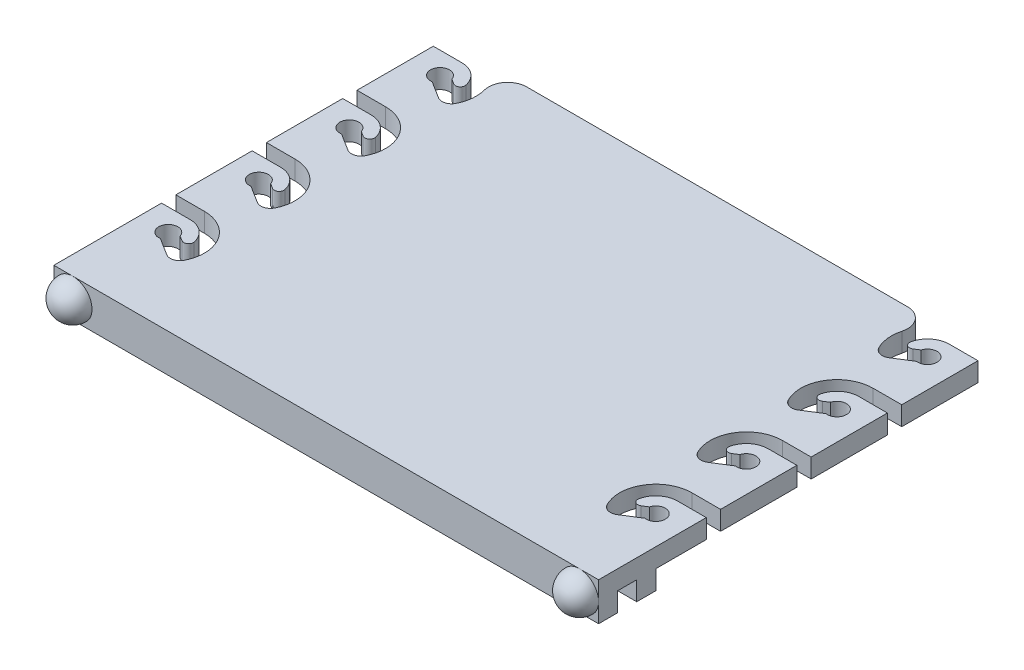
from build123d import *

# Parameters (mm, degrees)
SKETCH1_W            = 57.131427428
SKETCH1_H            = 41
BOSS_EXTRUDE1_DEPTH  = 2
SKETCH2_W            = 28.565713714
SKETCH2_H            = 2
BOSS_EXTRUDE2_DEPTH  = 2
CUT_EXTRUDE4_DEPTH   = 2
LPATTERN1_COUNT      = 4
LPATTERN1_PITCH      = 9.5
MIRROR2_COPY_1_DEPTH = 2
MIRROR2_COPY_2_DEPTH = 2
MIRROR2_COPY_3_DEPTH = 2
FILLET1_R            = 1
FILLET2_R            = 2


with BuildPart() as part:
    # Sketch1 → Boss-Extrude1 (new body)
    with BuildSketch(Plane(origin=(0, 0, 0), x_dir=(1, 0, 0), z_dir=(0, 1, 0))):
        with Locations((0, 20.5)):
            Rectangle(SKETCH1_W, SKETCH1_H)
    extrude(amount=BOSS_EXTRUDE1_DEPTH)

    # Sketch2 → Boss-Extrude2 (add)
    with BuildSketch(Plane.XZ):
        with Locations((-14.282856857, -1)):
            Rectangle(SKETCH2_W, SKETCH2_H)
        with Locations((14.282856857, -1)):
            Rectangle(SKETCH2_W, SKETCH2_H)
        Polygon((1.5, -20), (3.5, -20), (3.5, -6), (28.565713714, -6), (28.565713714, -4), (1.5, -4), align=None)
        Polygon((-28.565713714, -6), (-28.565713714, -4), (-1.5, -4), (-1.5, -20), (-3.5, -20), (-3.5, -6), align=None)
    extrude(amount=BOSS_EXTRUDE2_DEPTH)

    # Sketch4 → Revolve1 (revolve)
    with BuildSketch(Plane.XZ):
        with BuildLine():
            Line((-26.565713714, 0), (-28.565713714, 0))
            ThreePointArc((-28.565713714, 0), (-27.979927277, 1.414213562), (-26.565713714, 2))
            Line((-26.565713714, 2), (-26.565713714, 0))
        make_face()
    revolve1 = revolve(axis=Axis((-26.565713714, 0, 0), (0, 0, 1)))

    # Mirror1: Revolve1 across plane
    add(revolve1.mirror(Plane(origin=(0, 0, 0), x_dir=(0, 0, 1), z_dir=(1, 0, 0))))

    # Sketch7 → Cut-Extrude4 (cut)
    with BuildSketch(Plane(origin=(0, 2, 0), x_dir=(1, 0, 0), z_dir=(0, 1, 0))):
        with BuildLine():
            Line((-24.076247257, 8.949248512), (-24.606518128, 9.282743394))
            ThreePointArc((-24.606518128, 9.282743394), (-26.412219505, 9.532379514), (-25.405087398, 8.012984708))
            Line((-25.405087398, 8.012984708), (-24.129168598, 7.210541254))
            Line((-24.129168598, 7.210541254), (-23.60872049, 6.883224049))
            ThreePointArc((-23.60872049, 6.883224049), (-22.810789527, 6.765633149), (-22.185605476, 7.275207818))
            ThreePointArc((-22.185605476, 7.275207818), (-22.329575973, 10.981780083), (-25.565713714, 12.794738433))
            Line((-25.565713714, 12.794738433), (-28.565713714, 12.794738433))
            Line((-28.565713714, 12.794738433), (-28.565713714, 11.294738433))
            Line((-28.565713714, 11.294738433), (-25.565713714, 11.294738433))
            ThreePointArc((-25.565713714, 11.294738433), (-24.121260099, 10.783081105), (-23.320945498, 9.476277368))
            ThreePointArc((-23.320945498, 9.476277368), (-23.52393963, 8.962456819), (-24.076247257, 8.949248512))
        make_face()
    cut_extrude4 = extrude(amount=-CUT_EXTRUDE4_DEPTH, mode=Mode.SUBTRACT)

    # LPattern1: Cut-Extrude4 ×4
    with Locations(*[(0, 0, -i * LPATTERN1_PITCH) for i in range(1, LPATTERN1_COUNT)]):
        add(cut_extrude4, mode=Mode.SUBTRACT)

    # Mirror2: Cut-Extrude4 across plane
    add(cut_extrude4.mirror(Plane(origin=(0, 0, 0), x_dir=(0, 0, 1), z_dir=(1, 0, 0))), mode=Mode.SUBTRACT)

    # Mirror2 copy 1 sketch → Mirror2 copy 1 (cut)
    with BuildSketch(Plane(origin=(0, 2, -9.5), x_dir=(-1, 0, 0), z_dir=(0, 1, 0))):
        with BuildLine():
            Line((-24.076247257, -8.949248512), (-24.606518128, -9.282743394))
            ThreePointArc((-24.606518128, -9.282743394), (-26.412219505, -9.532379514), (-25.405087398, -8.012984708))
            Line((-25.405087398, -8.012984708), (-24.129168598, -7.210541254))
            Line((-24.129168598, -7.210541254), (-23.60872049, -6.883224049))
            ThreePointArc((-23.60872049, -6.883224049), (-22.810789527, -6.765633149), (-22.185605476, -7.275207818))
            ThreePointArc((-22.185605476, -7.275207818), (-22.329575973, -10.981780083), (-25.565713714, -12.794738433))
            Line((-25.565713714, -12.794738433), (-28.565713714, -12.794738433))
            Line((-28.565713714, -12.794738433), (-28.565713714, -11.294738433))
            Line((-28.565713714, -11.294738433), (-25.565713714, -11.294738433))
            ThreePointArc((-25.565713714, -11.294738433), (-24.121260099, -10.783081105), (-23.320945498, -9.476277368))
            ThreePointArc((-23.320945498, -9.476277368), (-23.52393963, -8.962456819), (-24.076247257, -8.949248512))
        make_face()
    extrude(amount=-MIRROR2_COPY_1_DEPTH, mode=Mode.SUBTRACT)

    # Mirror2 copy 2 sketch → Mirror2 copy 2 (cut)
    with BuildSketch(Plane(origin=(0, 2, -19), x_dir=(-1, 0, 0), z_dir=(0, 1, 0))):
        with BuildLine():
            Line((-24.076247257, -8.949248512), (-24.606518128, -9.282743394))
            ThreePointArc((-24.606518128, -9.282743394), (-26.412219505, -9.532379514), (-25.405087398, -8.012984708))
            Line((-25.405087398, -8.012984708), (-24.129168598, -7.210541254))
            Line((-24.129168598, -7.210541254), (-23.60872049, -6.883224049))
            ThreePointArc((-23.60872049, -6.883224049), (-22.810789527, -6.765633149), (-22.185605476, -7.275207818))
            ThreePointArc((-22.185605476, -7.275207818), (-22.329575973, -10.981780083), (-25.565713714, -12.794738433))
            Line((-25.565713714, -12.794738433), (-28.565713714, -12.794738433))
            Line((-28.565713714, -12.794738433), (-28.565713714, -11.294738433))
            Line((-28.565713714, -11.294738433), (-25.565713714, -11.294738433))
            ThreePointArc((-25.565713714, -11.294738433), (-24.121260099, -10.783081105), (-23.320945498, -9.476277368))
            ThreePointArc((-23.320945498, -9.476277368), (-23.52393963, -8.962456819), (-24.076247257, -8.949248512))
        make_face()
    extrude(amount=-MIRROR2_COPY_2_DEPTH, mode=Mode.SUBTRACT)

    # Mirror2 copy 3 sketch → Mirror2 copy 3 (cut)
    with BuildSketch(Plane(origin=(0, 2, -28.5), x_dir=(-1, 0, 0), z_dir=(0, 1, 0))):
        with BuildLine():
            Line((-24.076247257, -8.949248512), (-24.606518128, -9.282743394))
            ThreePointArc((-24.606518128, -9.282743394), (-26.412219505, -9.532379514), (-25.405087398, -8.012984708))
            Line((-25.405087398, -8.012984708), (-24.129168598, -7.210541254))
            Line((-24.129168598, -7.210541254), (-23.60872049, -6.883224049))
            ThreePointArc((-23.60872049, -6.883224049), (-22.810789527, -6.765633149), (-22.185605476, -7.275207818))
            ThreePointArc((-22.185605476, -7.275207818), (-22.329575973, -10.981780083), (-25.565713714, -12.794738433))
            Line((-25.565713714, -12.794738433), (-28.565713714, -12.794738433))
            Line((-28.565713714, -12.794738433), (-28.565713714, -11.294738433))
            Line((-28.565713714, -11.294738433), (-25.565713714, -11.294738433))
            ThreePointArc((-25.565713714, -11.294738433), (-24.121260099, -10.783081105), (-23.320945498, -9.476277368))
            ThreePointArc((-23.320945498, -9.476277368), (-23.52393963, -8.962456819), (-24.076247257, -8.949248512))
        make_face()
    extrude(amount=-MIRROR2_COPY_3_DEPTH, mode=Mode.SUBTRACT)

    # Fillet1
    fillet1_edges = [part.edges().sort_by_distance(p)[0] for p in [
        (1.5, -1, -4),
        (-1.5, -1, -4),
    ]]
    fillet(fillet1_edges, radius=FILLET1_R)

    # Fillet2
    fillet2_edges = [part.edges().sort_by_distance(p)[0] for p in [
        (-24.099412322, 1, -41),
        (24.099412322, 1, -41),
    ]]
    fillet(fillet2_edges, radius=FILLET2_R)


solid = part.part
